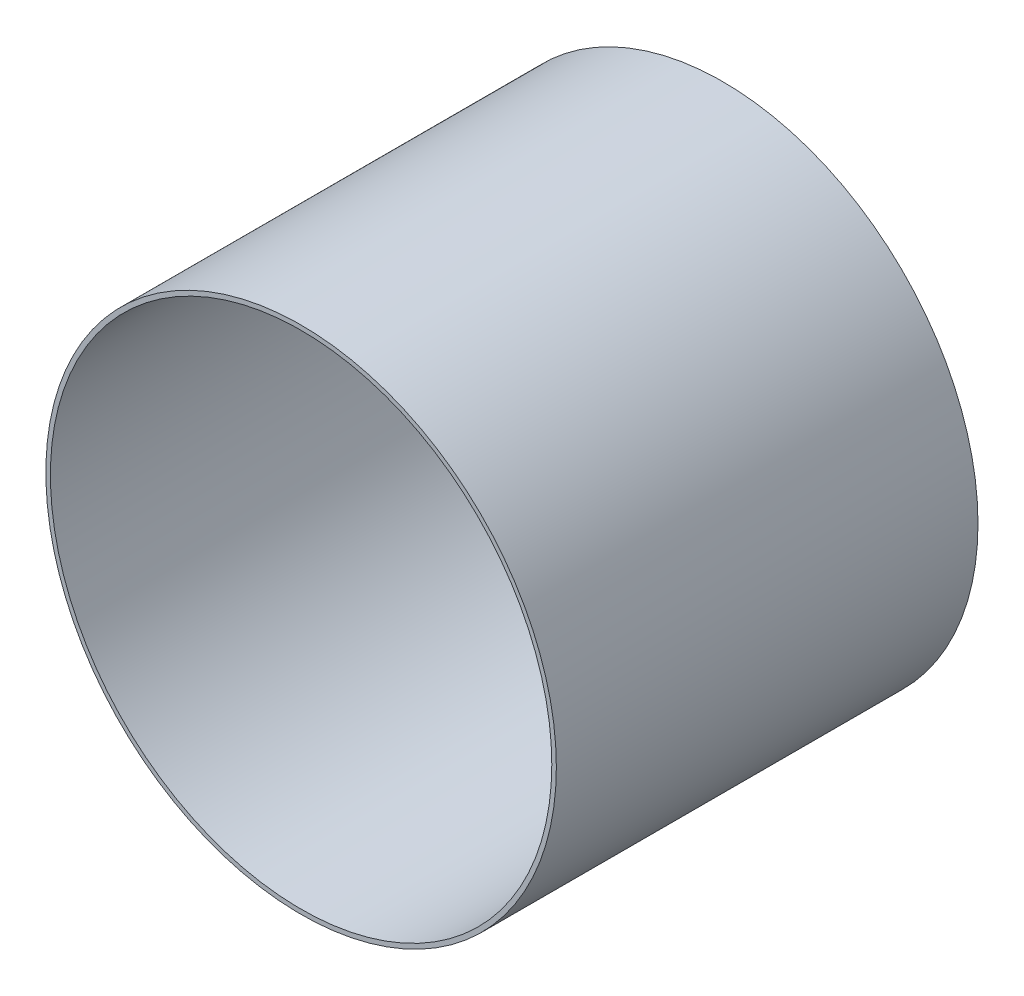
from build123d import *

# Parameters (mm, degrees)
SKETCH1_R      = 71.12
SKETCH1_R_2    = 69.85
EXTRUDE1_DEPTH = 117.475


with BuildPart() as part:
    # Sketch1 → Extrude1 (new body)
    with BuildSketch(Plane.XY):
        Circle(SKETCH1_R)
        Circle(SKETCH1_R_2, mode=Mode.SUBTRACT)
    extrude(amount=EXTRUDE1_DEPTH)


solid = part.part
